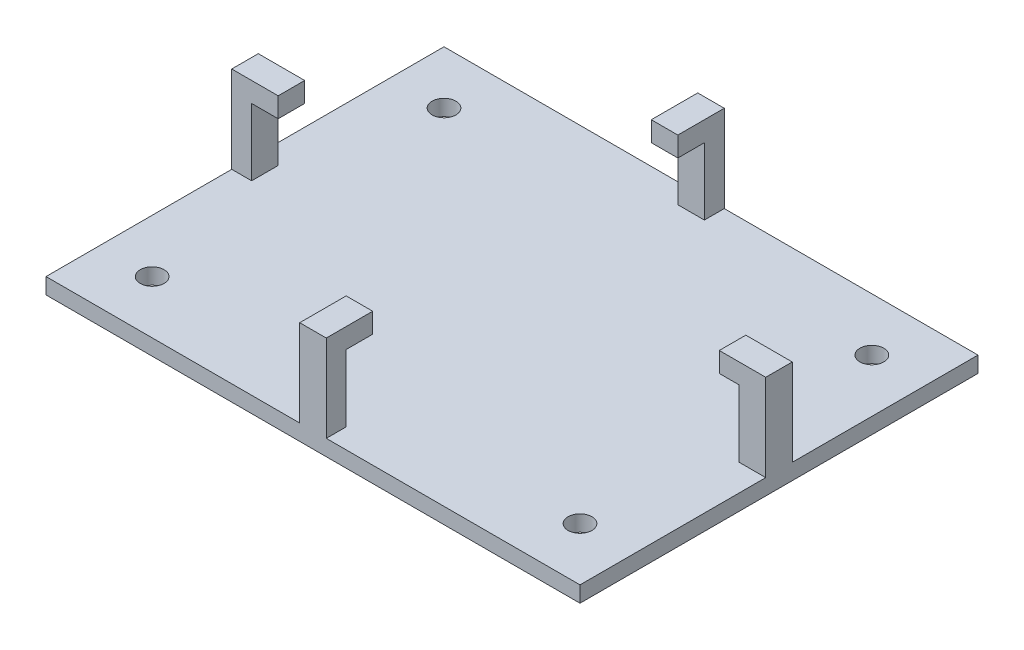
from build123d import *

# Parameters (mm, degrees)
SKETCH2_W           = 80.5
SKETCH2_H           = 60
SKETCH2_R           = 1.8
BOSS_EXTRUDE1_DEPTH = 2.4
SKETCH2_3_W         = 4
SKETCH2_3_H         = 4
SKETCH2_3_H_2       = 3
SKETCH2_3_W_2       = 3
BOSS_EXTRUDE2_DEPTH = 12.5
SKETCH3_W           = 4
SKETCH3_H           = 7
SKETCH3_W_2         = 7
SKETCH3_H_2         = 4
BOSS_EXTRUDE3_DEPTH = 3


with BuildPart() as part:
    # Sketch2 → Boss-Extrude1 (new body)
    with BuildSketch(Plane(origin=(0, 0, 0), x_dir=(1, 0, 0), z_dir=(0, 1, 0))):
        Rectangle(SKETCH2_W, SKETCH2_H)
        with Locations((32.25, 22)):
            Circle(SKETCH2_R, mode=Mode.SUBTRACT)
        with Locations((-32.25, -22)):
            Circle(SKETCH2_R, mode=Mode.SUBTRACT)
        with Locations((32.25, -22)):
            Circle(SKETCH2_R, mode=Mode.SUBTRACT)
        with Locations((-32.25, 22)):
            Circle(SKETCH2_R, mode=Mode.SUBTRACT)
    extrude(amount=BOSS_EXTRUDE1_DEPTH)

    # Sketch2<3> → Boss-Extrude2 (add)
    with BuildSketch(Plane(origin=(0, 0, 0), x_dir=(1, 0, 0), z_dir=(0, 1, 0))):
        with Locations((38.25, 0)):
            Rectangle(SKETCH2_3_W, SKETCH2_3_H)
        with Locations((0, -28.5)):
            Rectangle(SKETCH2_3_W, SKETCH2_3_H_2)
        with Locations((-38.75, 0)):
            Rectangle(SKETCH2_3_W_2, SKETCH2_3_H)
        with Locations((0, 28.5)):
            Rectangle(SKETCH2_3_W, SKETCH2_3_H_2)
    extrude(amount=BOSS_EXTRUDE2_DEPTH)

    # Sketch3 → Boss-Extrude3 (add)
    with BuildSketch(Plane(origin=(0, 12.5, 0), x_dir=(1, 0, 0), z_dir=(0, 1, 0))):
        with Locations((0, 26.5)):
            Rectangle(SKETCH3_W, SKETCH3_H)
        with Locations((-36.75, 0)):
            Rectangle(SKETCH3_W_2, SKETCH3_H_2)
        with Locations((0, -26.5)):
            Rectangle(SKETCH3_W, SKETCH3_H)
        with Locations((36.75, 0)):
            Rectangle(SKETCH3_W_2, SKETCH3_H_2)
    extrude(amount=BOSS_EXTRUDE3_DEPTH)


solid = part.part
